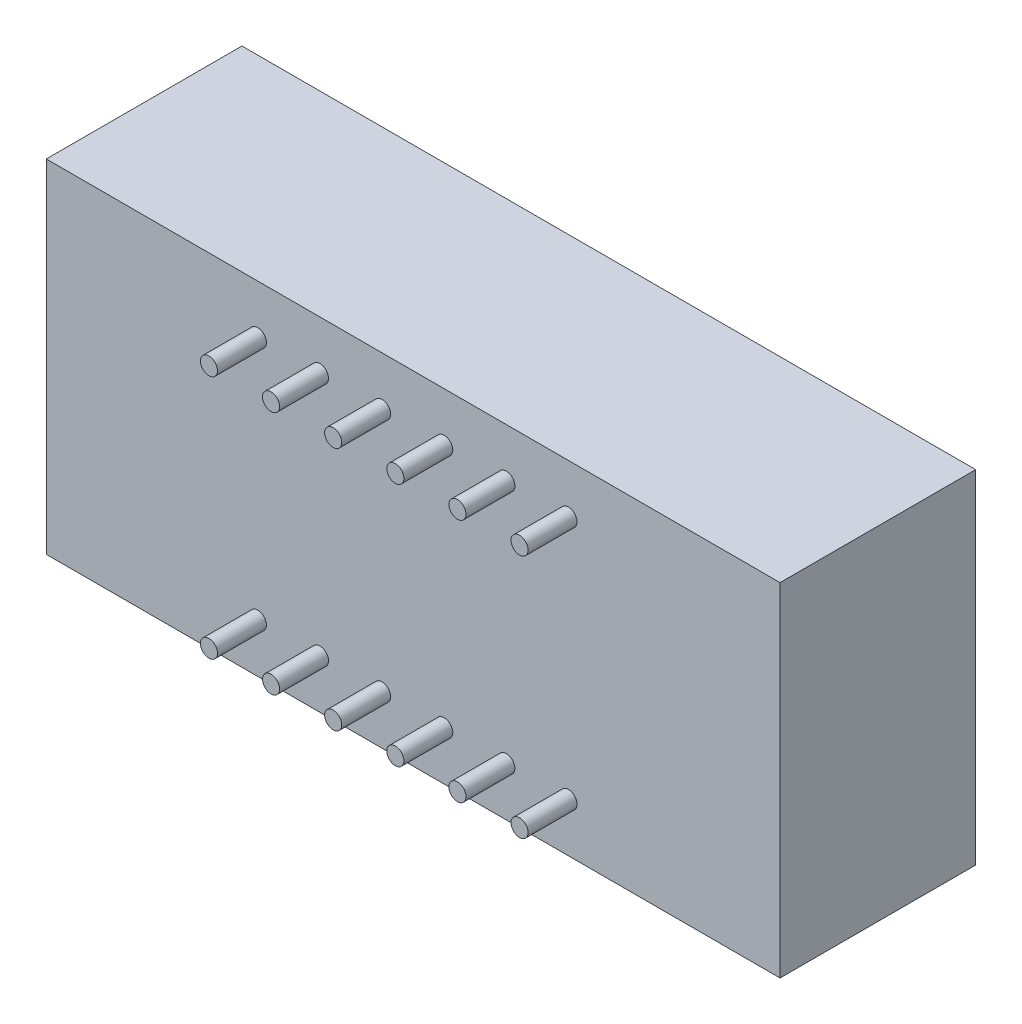
from build123d import *

# Parameters (mm, degrees)
SKETCH_1_W      = 30
SKETCH_1_H      = 14
EXTRUDE_1_DEPTH = 8
SKETCH_2_R      = 0.35
EXTRUDE_2_DEPTH = 2


with BuildPart() as part:
    # 草图1 → 凸台-拉伸1 (new body)
    with BuildSketch(Plane.XY):
        with Locations((15, 7)):
            Rectangle(SKETCH_1_W, SKETCH_1_H)
    extrude(amount=EXTRUDE_1_DEPTH)

    # 草图2 → 凸台-拉伸2 (add)
    with BuildSketch(Plane.XY.offset(8)):
        with Locations(Location((13.73, 12, 0), (0, 0, 180))):
            Circle(SKETCH_2_R)
        with Locations(Location((16.27, 12, 0), (0, 0, 180))):
            Circle(SKETCH_2_R)
        with Locations(Location((18.81, 12, 0), (0, 0, 180))):
            Circle(SKETCH_2_R)
        with Locations(Location((21.35, 12, 0), (0, 0, 180))):
            Circle(SKETCH_2_R)
        with Locations(Location((13.73, 2, 0), (0, 0, 180))):
            Circle(SKETCH_2_R)
        with Locations(Location((16.27, 2, 0), (0, 0, 180))):
            Circle(SKETCH_2_R)
        with Locations(Location((18.81, 2, 0), (0, 0, 180))):
            Circle(SKETCH_2_R)
        with Locations(Location((21.35, 2, 0), (0, 0, 180))):
            Circle(SKETCH_2_R)
        with Locations(Location((11.19, 12, 0), (0, 0, 180))):
            Circle(SKETCH_2_R)
        with Locations(Location((8.65, 12, 0), (0, 0, 180))):
            Circle(SKETCH_2_R)
        with Locations(Location((11.19, 2, 0), (0, 0, 180))):
            Circle(SKETCH_2_R)
        with Locations(Location((8.65, 2, 0), (0, 0, 180))):
            Circle(SKETCH_2_R)
    extrude(amount=EXTRUDE_2_DEPTH)


solid = part.part
